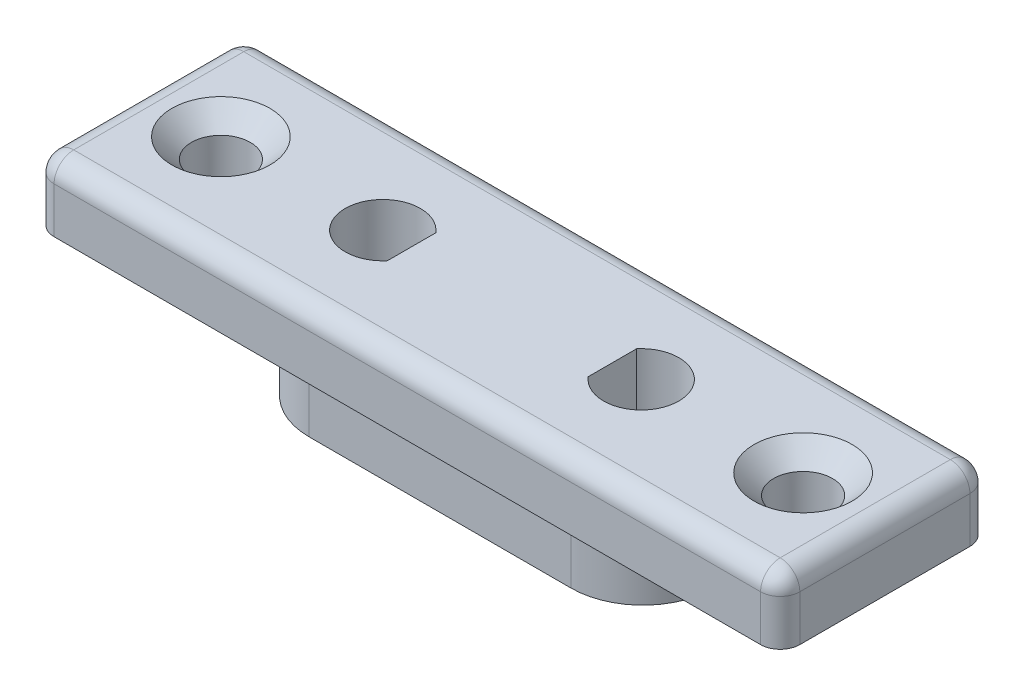
from build123d import *

# Parameters (mm, degrees)
SKETCH_1_W          = 57
SKETCH_1_H          = 16
EXTRUDE_1_DEPTH     = 5
FILLET_1_R          = 1.5
CUT_EXTRUDE_1_DEPTH = 15
HOLE_WIZARD_M41_D   = 4.5
CHAMFER_1_SIZE      = 1.5
EXTRUDE_2_DEPTH     = 6
SKETCH_9_R          = 2.25
CUT_EXTRUDE_2_DEPTH = 9.25
EXTRUDE_START       = 0.1
SKETCH_10_R         = 4
SKETCH_10_R_2       = 2.25
EXTRUDE_3_DEPTH     = 0.1


with BuildPart() as part:
    # Эскиз1 → Бобышка-Вытянуть1 (new body)
    with BuildSketch(Plane(origin=(0, 0, 0), x_dir=(1, 0, 0), z_dir=(0, 1, 0))):
        with Locations((28.5, 8)):
            Rectangle(SKETCH_1_W, SKETCH_1_H)
    extrude(amount=EXTRUDE_1_DEPTH)

    # Скругление1
    fillet_1_edges = [part.edges().sort_by_distance(p)[0] for p in [
        (28.5, 5, -16),
        (0, 5, -8),
        (28.5, 5, 0),
        (57, 5, -8),
        (0, 2.5, 0),
        (0, 2.5, -16),
        (57, 2.5, -16),
        (57, 2.5, 0),
    ]]
    fillet(fillet_1_edges, radius=FILLET_1_R)

    # Эскиз2 → Вырез-Вытянуть1 (cut)
    with BuildSketch(Plane(origin=(0, 5, 0), x_dir=(1, 0, 0), z_dir=(0, 1, 0))):
        with BuildLine():
            Line((36.175, 9.850844402), (36.175, 6.149155598))
            ThreePointArc((36.175, 6.149155598), (41.25, 8), (36.175, 9.850844402))
        make_face()
        with BuildLine():
            Line((20.825, 9.850844402), (20.825, 6.149155598))
            ThreePointArc((20.825, 6.149155598), (15.75, 8), (20.825, 9.850844402))
        make_face()
    extrude(amount=-CUT_EXTRUDE_1_DEPTH, mode=Mode.SUBTRACT)

    # Отверстие с зазором M41 (through all)
    with Locations(Plane(origin=(0, 5, 0), x_dir=(1, 0, 0), z_dir=(0, 1, 0))):
        with Locations((6.25, 8), (50.75, 8)):
            Hole(HOLE_WIZARD_M41_D / 2)

    # Фаска1
    chamfer_1_edges = [part.edges().sort_by_distance(p)[0] for p in [
        (53, 5, -8),
        (8.5, 5, -8),
    ]]
    chamfer(chamfer_1_edges, length=CHAMFER_1_SIZE)

    # Эскиз8 → Бобышка-Вытянуть2 (add)
    with BuildSketch(Plane.XZ):
        with BuildLine():
            Line((38.5, -2.5), (18.5, -2.5))
            ThreePointArc((18.5, -2.5), (13, -8), (18.5, -13.5))
            Line((18.5, -13.5), (38.5, -13.5))
            ThreePointArc((38.5, -13.5), (44, -8), (38.5, -2.5))
        make_face()
        with BuildLine():
            Line((36.175, -6.149155598), (36.175, -9.850844402))
            ThreePointArc((36.175, -9.850844402), (41.25, -8), (36.175, -6.149155598))
        make_face(mode=Mode.SUBTRACT)
        with BuildLine():
            Line((20.825, -9.850844402), (20.825, -6.149155598))
            ThreePointArc((20.825, -6.149155598), (15.75, -8), (20.825, -9.850844402))
        make_face(mode=Mode.SUBTRACT)
    extrude(amount=EXTRUDE_2_DEPTH)

    # Эскиз9 → Вырез-Вытянуть2 (cut)
    with BuildSketch(Plane.XZ.offset(6)):
        with Locations(Location((28.5, -8, 0), (0, 0, 270))):
            Circle(SKETCH_9_R)
    extrude(amount=-CUT_EXTRUDE_2_DEPTH, mode=Mode.SUBTRACT)

    # Эскиз10 → Бобышка-Вытянуть3 (add)
    with BuildSketch(Plane.XZ.offset(6).offset(EXTRUDE_START)):
        with Locations(Location((28.5, -8, 0), (0, 0, 270))):
            Circle(SKETCH_10_R)
        with Locations(Location((28.5, -8, 0), (0, 0, 270))):
            Circle(SKETCH_10_R_2, mode=Mode.SUBTRACT)
    extrude(amount=-EXTRUDE_3_DEPTH)


solid = part.part
